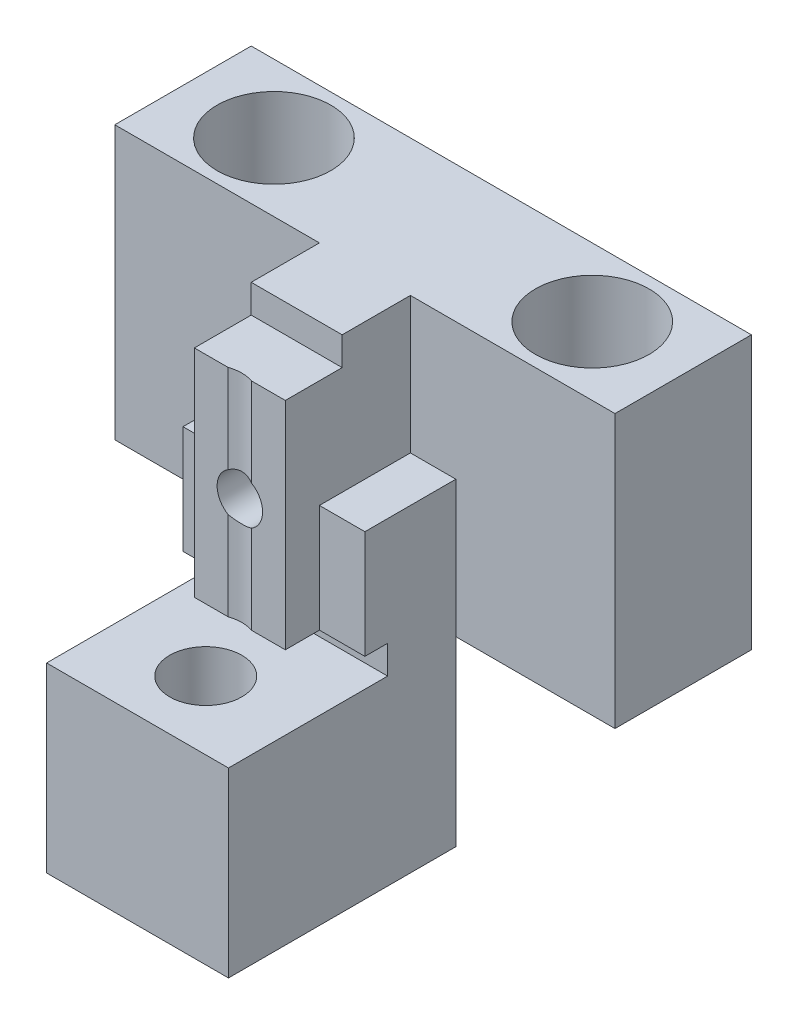
from build123d import *

# Parameters (mm, degrees)
SKETCH1_W                                   = 44
SKETCH1_H                                   = 24
CROSSHEAD_BASE_DEPTH                        = 12
SHOE_UPRISER_START                          = 12
SKETCH2_W                                   = 8
SKETCH2_H                                   = 24
SHOE_UPRISER_DEPTH                          = 11
ADAPTER_BRIDGE_START                        = 12
SKETCH3_W                                   = 16
SKETCH3_H                                   = 28
ADAPTER_BRIDGE_DEPTH                        = 8
THREADED_ROD_ADAPTER_START                  = 20
SKETCH4_W                                   = 16
SKETCH4_H                                   = 16
THREADED_ROD_ADAPTER_DEPTH                  = 12
TWO_BRONZE_BUSH_HOUSINGS_DEPTH              = 48.874836814
TWO_BRONZE_BUSH_HOUSINGS_DEPTH_BACK         = 48.874836814
SKETCH5_R                                   = 5
QUARTER20_ADAPTER_MAJOR_ENVELOPE_DEPTH      = 48.874836814
QUARTER20_ADAPTER_MAJOR_ENVELOPE_DEPTH_BACK = 48.874836814
SKETCH6_R                                   = 3.175
SKETCH7_R                                   = 2
M4_SHOE_THREAD_MAJOR_ENVELOPE_DEPTH         = 11
CROSS_SLOT_BOTTOM_CLEARANCE_DEPTH           = 48.874836873
CROSS_SLOT_BOTTOM_CLEARANCE_DEPTH_BACK      = 48.874836873
SKETCH8_W                                   = 5.5
SKETCH8_H                                   = 2.5
SKETCH8_H_2                                 = 3


with BuildPart() as part:
    # Sketch1 → Crosshead_Base (new body)
    with BuildSketch(Plane.XY):
        Rectangle(SKETCH1_W, SKETCH1_H)
    extrude(amount=CROSSHEAD_BASE_DEPTH)

    # Sketch2 → Shoe_Upriser (add)
    with BuildSketch(Plane.XY.offset(SHOE_UPRISER_START)):
        Rectangle(SKETCH2_W, SKETCH2_H)
    extrude(amount=SHOE_UPRISER_DEPTH)

    # Sketch3 → Adapter_Bridge (add)
    with BuildSketch(Plane.XY.offset(ADAPTER_BRIDGE_START)):
        with Locations((0, -14)):
            Rectangle(SKETCH3_W, SKETCH3_H)
    extrude(amount=ADAPTER_BRIDGE_DEPTH)

    # Sketch4 → Threaded_Rod_Adapter (add)
    with BuildSketch(Plane.XY.offset(THREADED_ROD_ADAPTER_START)):
        with Locations((0, -20)):
            Rectangle(SKETCH4_W, SKETCH4_H)
    extrude(amount=THREADED_ROD_ADAPTER_DEPTH)

    # Sketch5 → Two_Bronze_Bush_Housings (cut, two sides: drawn at the far end of the back side and taken through both)
    with BuildSketch(Plane(origin=(0, 0, 0), x_dir=(1, 0, 0), z_dir=(0, 1, 0)).offset(-TWO_BRONZE_BUSH_HOUSINGS_DEPTH_BACK)):
        with Locations(Location((-14, -6, 0), (0, 0, 270))):
            Circle(SKETCH5_R)
        with Locations(Location((14, -6, 0), (0, 0, 270))):
            Circle(SKETCH5_R)
    extrude(amount=TWO_BRONZE_BUSH_HOUSINGS_DEPTH + TWO_BRONZE_BUSH_HOUSINGS_DEPTH_BACK, mode=Mode.SUBTRACT)

    # Sketch6 → Quarter20_Adapter_Major_Envelope (cut, two sides: drawn at the far end of the back side and taken through both)
    with BuildSketch(Plane(origin=(0, 0, 0), x_dir=(1, 0, 0), z_dir=(0, 1, 0)).offset(-QUARTER20_ADAPTER_MAJOR_ENVELOPE_DEPTH_BACK)):
        with Locations(Location((0, -26, 0), (0, 0, 270))):
            Circle(SKETCH6_R)
    extrude(amount=QUARTER20_ADAPTER_MAJOR_ENVELOPE_DEPTH + QUARTER20_ADAPTER_MAJOR_ENVELOPE_DEPTH_BACK, mode=Mode.SUBTRACT)

    # Sketch7 → M4_Shoe_Thread_Major_Envelope (cut)
    with BuildSketch(Plane.XY.offset(23)):
        Circle(SKETCH7_R)
    extrude(amount=-M4_SHOE_THREAD_MAJOR_ENVELOPE_DEPTH, mode=Mode.SUBTRACT)

    # Sketch8 → Cross_Slot_Bottom_Clearance (cut, two sides: drawn at the far end of the back side and taken through both)
    with BuildSketch(Plane(origin=(0, 0, 0), x_dir=(0, 0, -1), z_dir=(1, 0, 0)).offset(-CROSS_SLOT_BOTTOM_CLEARANCE_DEPTH_BACK)):
        with Locations((-20.75, -10.75)):
            Rectangle(SKETCH8_W, SKETCH8_H)
        with Locations((-20.75, 11)):
            Rectangle(SKETCH8_W, SKETCH8_H_2)
    extrude(amount=CROSS_SLOT_BOTTOM_CLEARANCE_DEPTH + CROSS_SLOT_BOTTOM_CLEARANCE_DEPTH_BACK, mode=Mode.SUBTRACT)


solid = part.part
